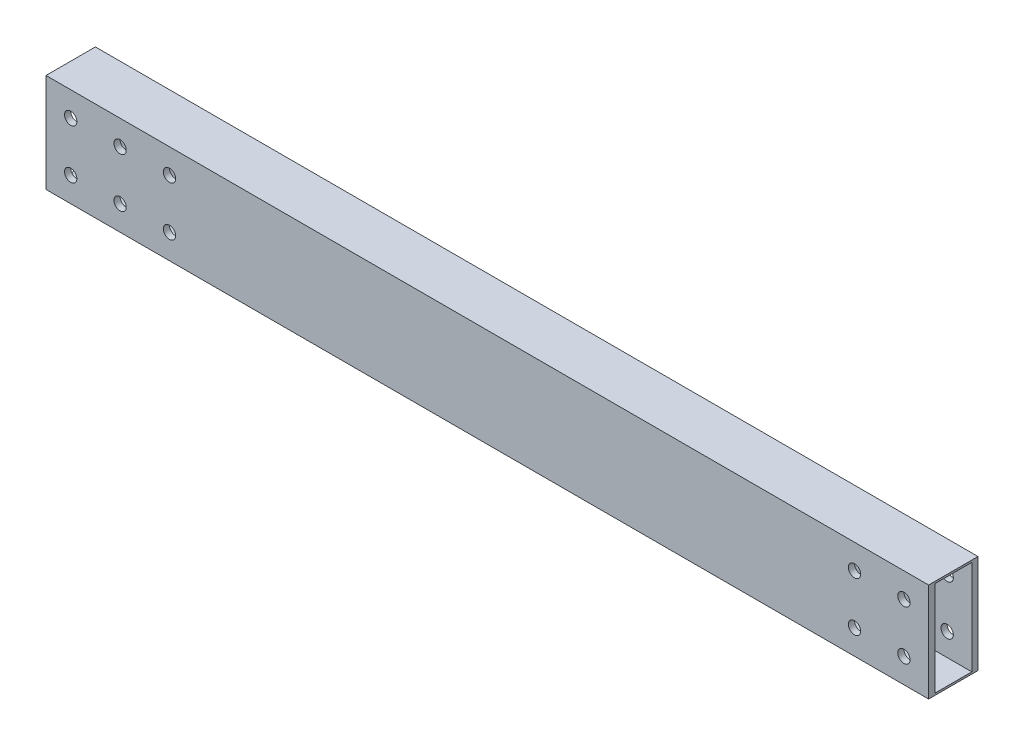
from build123d import *

# Parameters (mm, degrees)
SKETCH1_W               = 25.4
SKETCH1_H               = 50.8
BOSS_EXTRUDE1_DEPTH     = 453.936862
SKETCH2_W               = 19.05
SKETCH2_H               = 48.768
CUT_EXTRUDE1_DEPTH      = 458.47620122
CUT_EXTRUDE4_DEPTH      = 458.47620122
CUT_EXTRUDE4_DEPTH_BACK = 458.47620122
SKETCH5_R               = 3.175


with BuildPart() as part:
    # Sketch1 → Boss-Extrude1 (new body)
    with BuildSketch(Plane(origin=(0, 0, 0), x_dir=(0, 0, -1), z_dir=(1, 0, 0))):
        with Locations((12.7, 25.4)):
            Rectangle(SKETCH1_W, SKETCH1_H)
    extrude(amount=BOSS_EXTRUDE1_DEPTH)

    # Sketch2 → Cut-Extrude1 (cut, through all)
    with BuildSketch(Plane(origin=(453.936862, 0, 0), x_dir=(0, 0, -1), z_dir=(1, 0, 0))):
        with Locations((12.7, 25.4)):
            Rectangle(SKETCH2_W, SKETCH2_H)
    extrude(amount=-CUT_EXTRUDE1_DEPTH, mode=Mode.SUBTRACT)

    # Sketch5 → Cut-Extrude4 (cut, two sides: drawn at the far end of the back side and taken through both)
    with BuildSketch(Plane.XY.offset(-CUT_EXTRUDE4_DEPTH_BACK)):
        with Locations((12.7, 38.1)):
            Circle(SKETCH5_R)
        with Locations((38.1, 38.1)):
            Circle(SKETCH5_R)
        with Locations((12.7, 12.7)):
            Circle(SKETCH5_R)
        with Locations((38.1, 12.7)):
            Circle(SKETCH5_R)
        with Locations((63.5, 38.1)):
            Circle(SKETCH5_R)
        with Locations((63.5, 12.7)):
            Circle(SKETCH5_R)
        with Locations((441.236862, 38.1)):
            Circle(SKETCH5_R)
        with Locations((441.236862, 12.7)):
            Circle(SKETCH5_R)
        with Locations((415.836862, 38.1)):
            Circle(SKETCH5_R)
        with Locations((415.836862, 12.7)):
            Circle(SKETCH5_R)
    extrude(amount=CUT_EXTRUDE4_DEPTH + CUT_EXTRUDE4_DEPTH_BACK, mode=Mode.SUBTRACT)


solid = part.part
